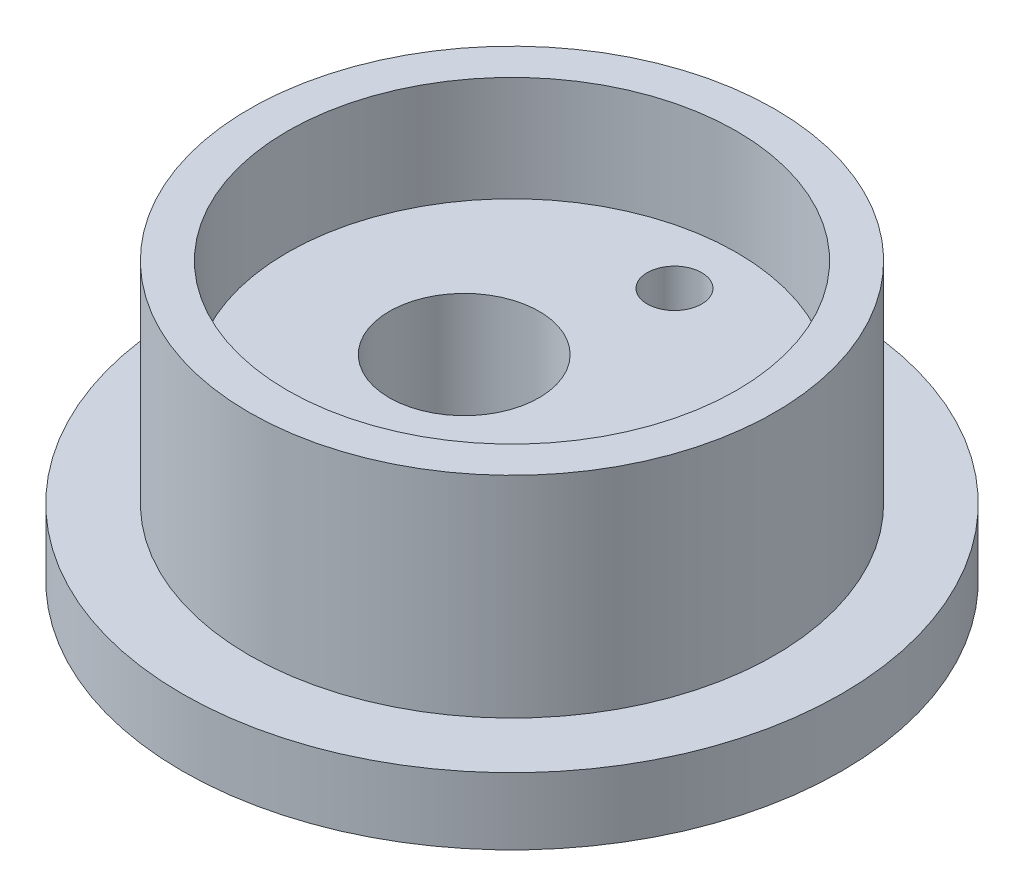
from build123d import *

# Parameters (mm, degrees)
SKETCH2_R          = 199.136
SKETCH2_R_2        = 72.39
CUT_EXTRUDE1_DEPTH = 1321.92210974


with BuildPart() as part:
    # Sketch1 → Revolve1 (revolve)
    with BuildSketch(Plane.XY, mode=Mode.PRIVATE) as revolve1_sk:
        Polygon((0, 0), (876.3, 0), (876.3, 177.8), (698.5, 177.8), (698.5, 736.6), (596.9, 736.6), (596.9, 457.2), (0, 457.2), align=None)
    revolve(revolve1_sk.sketch.rotate(Axis((0, -147.183312333, 0), (0, 1, 0)), 90), axis=Axis((0, -147.183312333, 0), (0, 1, 0)))

    # Sketch2 → Cut-Extrude1 (cut, through all)
    with BuildSketch(Plane(origin=(0, 457.2, 0), x_dir=(1, 0, 0), z_dir=(0, 1, 0))):
        with Locations(Location((-127, 0, 0), (0, 0, 270))):
            Circle(SKETCH2_R)
        with Locations(Location((0, 431.8, 0), (0, 0, 270))):
            Circle(SKETCH2_R_2)
        with Locations(Location((431.8, 0, 0), (0, 0, 270))):
            Circle(SKETCH2_R_2)
        with Locations(Location((0, -431.8, 0), (0, 0, 270))):
            Circle(SKETCH2_R_2)
    extrude(amount=-CUT_EXTRUDE1_DEPTH, mode=Mode.SUBTRACT)


solid = part.part
